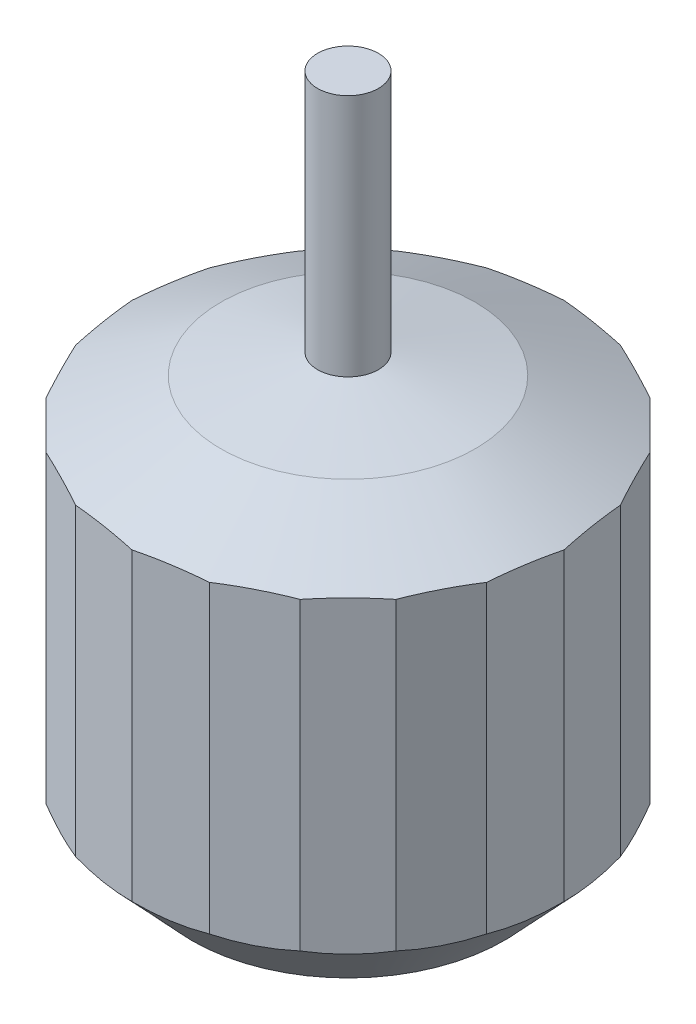
from build123d import *

# Parameters (mm, degrees)
SKETCH2_OUTSIDE_W  = 54.332
SKETCH2_OUTSIDE_H  = 54.332
CUT_EXTRUDE2_DEPTH = 69.393971984


with BuildPart() as part:
    # Sketch1 → Revolve2 (revolve)
    with BuildSketch(Plane.XY, mode=Mode.PRIVATE) as revolve2_sk:
        Polygon((0, 0), (6.749601751, 2.795776586), (13.028153792, 7.138607178), (18.025292424, 12.467968867), (18.025292424, 37.870552131), (10.605112725, 41.454777816), (2.54, 43.145841757), (2.54, 63.465841757), (0, 63.465841757), align=None)
    revolve(revolve2_sk.sketch.rotate(Axis((0, 63.465841757, 0), (0, -1, 0)), 90), axis=Axis((0, 63.465841757, 0), (0, -1, 0)))

    # Sketch2 outside → Cut-Extrude2 (cut, through all)
    with BuildSketch(Plane(origin=(0, 63.465841757, 0), x_dir=(1, 0, 0), z_dir=(0, 1, 0))):
        Rectangle(SKETCH2_OUTSIDE_W, SKETCH2_OUTSIDE_H)
        Polygon((-10.595001055, 14.582767899), (-14.582767899, 10.595001055), (-17.143071818, 5.570121687), (-18.025292424, 0), (-17.143071818, -5.570121687), (-14.582767899, -10.595001055), (-10.595001055, -14.582767899), (-5.570121687, -17.143071818), (0, -18.025292424), (5.570121687, -17.143071818), (10.595001055, -14.582767899), (14.582767899, -10.595001055), (17.143071818, -5.570121687), (18.025292424, 0), (17.143071818, 5.570121687), (14.582767899, 10.595001055), (10.595001055, 14.582767899), (5.570121687, 17.143071818), (0, 18.025292424), (-5.570121687, 17.143071818), align=None, mode=Mode.SUBTRACT)
    extrude(amount=-CUT_EXTRUDE2_DEPTH, mode=Mode.SUBTRACT)


solid = part.part
